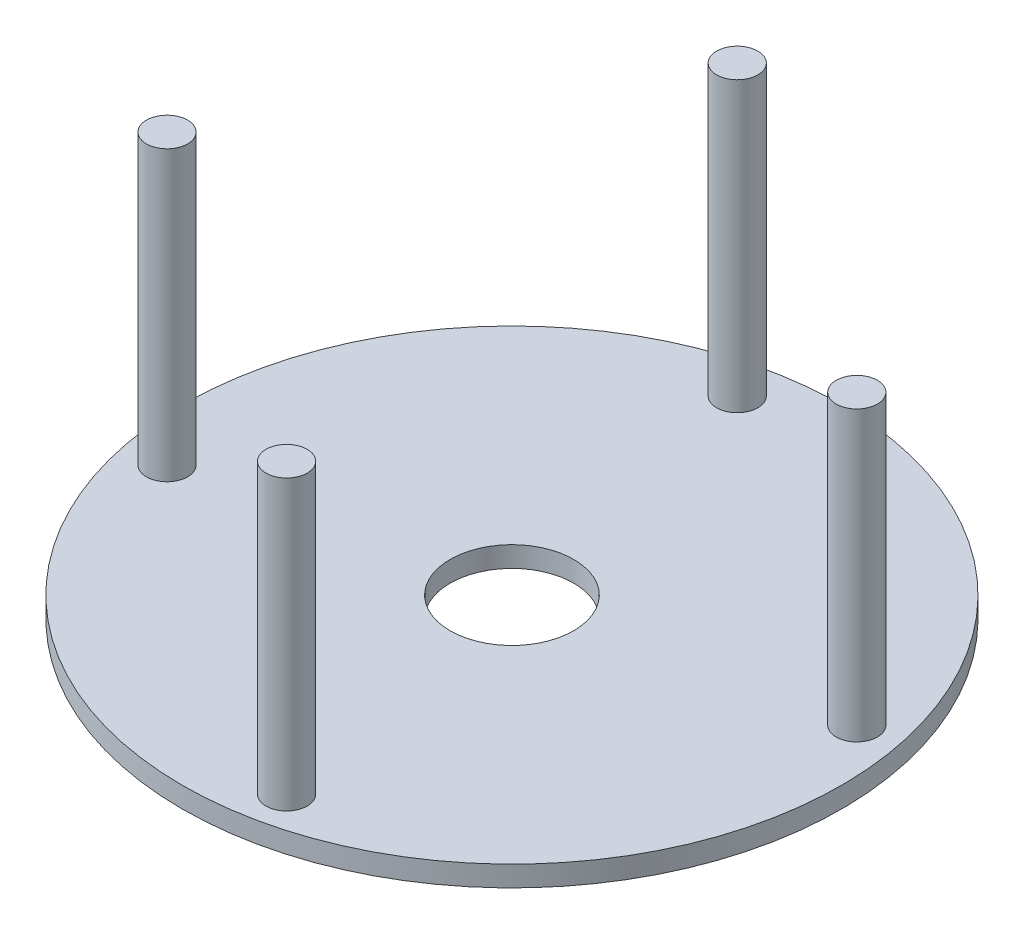
from build123d import *

# Parameters (mm, degrees)
SKETCH1_R           = 50.8
SKETCH1_R_2         = 9.525
BOSS_EXTRUDE1_DEPTH = 3.175
SKETCH2_R           = 3.175
BOSS_EXTRUDE2_DEPTH = 44.45


with BuildPart() as part:
    # Sketch1 → Boss-Extrude1 (new body)
    with BuildSketch(Plane(origin=(0, 0, 0), x_dir=(1, 0, 0), z_dir=(0, 1, 0))):
        with Locations(Location((0, 0, 0), (0, 0, 270))):
            Circle(SKETCH1_R)
        with Locations(Location((0, 0, 0), (0, 0, 270))):
            Circle(SKETCH1_R_2, mode=Mode.SUBTRACT)
    extrude(amount=BOSS_EXTRUDE1_DEPTH)

    # Sketch2 → Boss-Extrude2 (add)
    with BuildSketch(Plane(origin=(0, 3.175, 0), x_dir=(1, 0, 0), z_dir=(0, 1, 0))):
        with Locations(Location((-9.214642662, 43.945595463, 0), (0, 0, 270))):
            Circle(SKETCH2_R)
        with Locations(Location((43.945595463, 9.214642662, 0), (0, 0, 270))):
            Circle(SKETCH2_R)
        with Locations(Location((9.214642662, -43.945595463, 0), (0, 0, 270))):
            Circle(SKETCH2_R)
        with Locations(Location((-43.945595463, -9.214642662, 0), (0, 0, 270))):
            Circle(SKETCH2_R)
    extrude(amount=BOSS_EXTRUDE2_DEPTH)


solid = part.part
